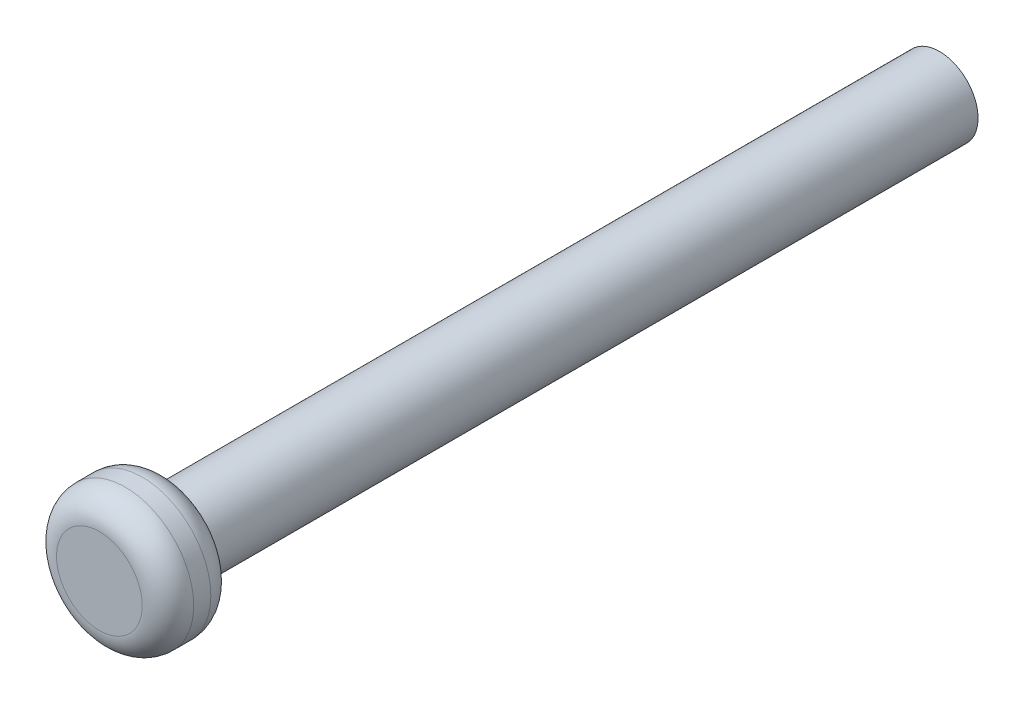
from build123d import *

# Parameters (mm, degrees)
SKETCH1_R           = 2.25
BOSS_EXTRUDE1_DEPTH = 45
SKETCH2_R           = 4
BOSS_EXTRUDE2_DEPTH = 4
FILLET1_R           = 1.5


with BuildPart() as part:
    # Sketch1 → Boss-Extrude1 (new body)
    with BuildSketch(Plane.XY):
        with Locations(Location((0, 0, 0), (0, 0, 180))):
            Circle(SKETCH1_R)
    extrude(amount=BOSS_EXTRUDE1_DEPTH)

    # Sketch2 → Boss-Extrude2 (add)
    with BuildSketch(Plane.XY.offset(45)):
        Circle(SKETCH2_R)
    extrude(amount=BOSS_EXTRUDE2_DEPTH)

    # Fillet1
    fillet1_edges = [part.edges().sort_by_distance(p)[0] for p in [
        (-4, 0, 45),
        (-4, 0, 49),
    ]]
    fillet(fillet1_edges, radius=FILLET1_R)


solid = part.part
